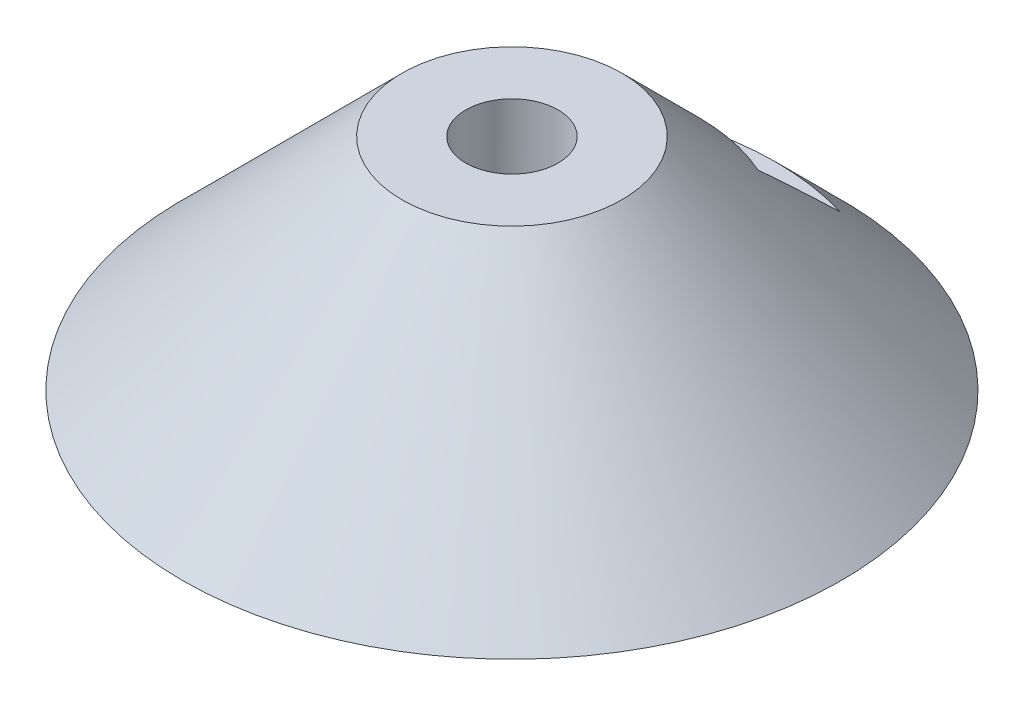
from build123d import *

# Parameters (mm, degrees)
SKETCH3_R           = 4.2
CUT_EXTRUDE1_DEPTH  = 10
SKETCH6_W           = 13.7
SKETCH6_H           = 7
CUT_EXTRUDE8_DEPTH  = 59
CUT_EXTRUDE9_DEPTH  = 7
SKETCH8_W           = 2
SKETCH8_H           = 4
CUT_EXTRUDE10_DEPTH = 61


with BuildPart() as part:
    # Sketch2 → Revolve1 (revolve)
    with BuildSketch(Plane.XY, mode=Mode.PRIVATE) as revolve1_sk:
        Polygon((0, 20), (10, 20), (30, 0), (0, 0), align=None)
    revolve(revolve1_sk.sketch.rotate(Axis((0, 0, 0), (0, 1, 0)), 90), axis=Axis((0, 0, 0), (0, 1, 0)))

    # Sketch3 → Cut-Extrude1 (cut)
    with BuildSketch(Plane(origin=(0, 20, 0), x_dir=(1, 0, 0), z_dir=(0, 1, 0))):
        with Locations(Location((0, 0, 0), (0, 0, 270))):
            Circle(SKETCH3_R)
    extrude(amount=-CUT_EXTRUDE1_DEPTH, mode=Mode.SUBTRACT)

    # Sketch6 → Cut-Extrude8 (cut)
    with BuildSketch(Plane.XY):
        with Locations((0, 9.5)):
            Rectangle(SKETCH6_W, SKETCH6_H)
    extrude(amount=-CUT_EXTRUDE8_DEPTH, mode=Mode.SUBTRACT)

    # Sketch7 → Cut-Extrude9 (cut)
    with BuildSketch(Plane(origin=(0, 6, 0), x_dir=(1, 0, 0), z_dir=(0, 1, 0))):
        Polygon((6.85, -3.954849344), (6.85, 3.954849344), (0, 7.909698688), (-6.85, 3.954849344), (-6.85, -3.954849344), (0, -7.909698688), align=None)
    extrude(amount=CUT_EXTRUDE9_DEPTH, mode=Mode.SUBTRACT)

    # Sketch8 → Cut-Extrude10 (cut)
    with BuildSketch(Plane.XY):
        Rectangle(SKETCH8_W, SKETCH8_H)
    extrude(amount=-CUT_EXTRUDE10_DEPTH, mode=Mode.SUBTRACT)


solid = part.part
